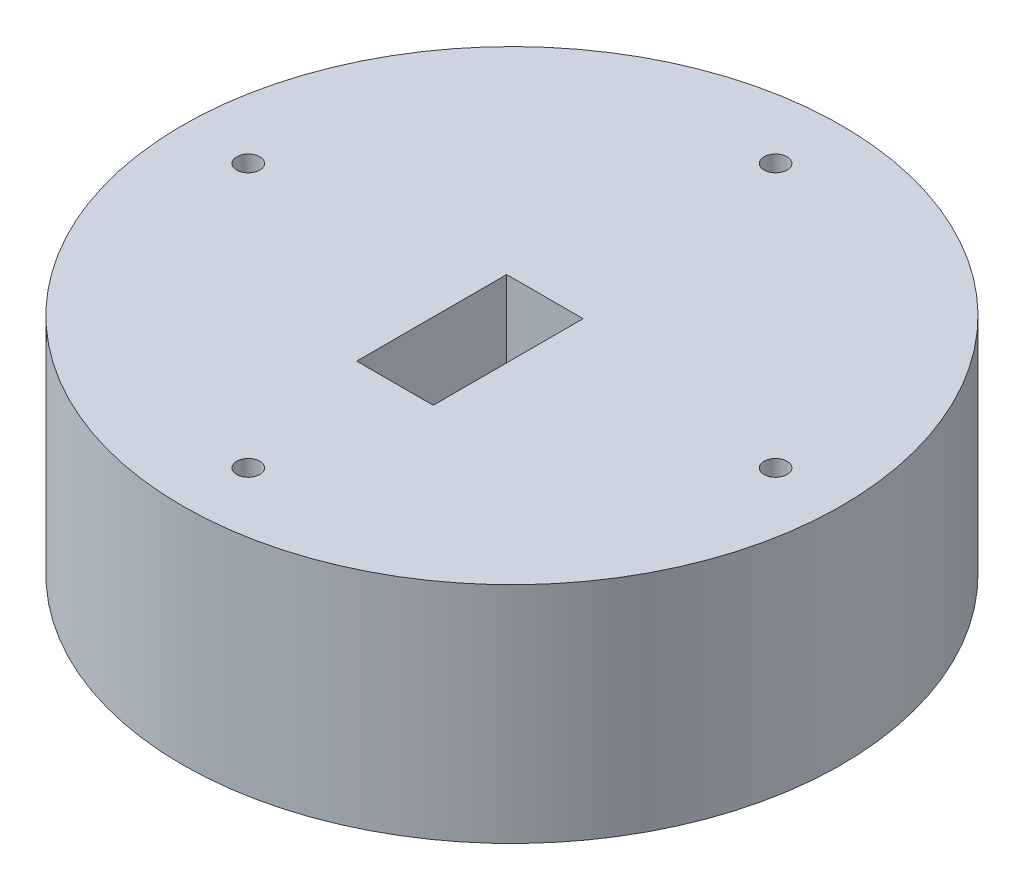
from build123d import *

# Parameters (mm, degrees)
SKETCH1_R           = 50
BOSS_EXTRUDE1_DEPTH = 30
SKETCH2_R           = 50
BOSS_EXTRUDE2_DEPTH = 4
SKETCH3_W           = 11.6
SKETCH3_H           = 22.75
CUT_EXTRUDE1_DEPTH  = 14
SKETCH5_R           = 1.75
CUT_EXTRUDE3_DEPTH  = 79.460180984


with BuildPart() as part:
    # Sketch1 → Boss-Extrude1 (new body)
    with BuildSketch(Plane(origin=(0, 0, 0), x_dir=(1, 0, 0), z_dir=(0, 1, 0))):
        with Locations(Location((0, 0, 0), (0, 0, 270))):
            Circle(SKETCH1_R)
    extrude(amount=BOSS_EXTRUDE1_DEPTH)

    # Sketch2 → Boss-Extrude2 (add)
    with BuildSketch(Plane(origin=(0, 30, 0), x_dir=(1, 0, 0), z_dir=(0, 1, 0))):
        with Locations(Location((0, 0, 0), (0, 0, 270))):
            Circle(SKETCH2_R)
    extrude(amount=BOSS_EXTRUDE2_DEPTH)

    # Sketch3 → Cut-Extrude1 (cut)
    with BuildSketch(Plane(origin=(0, 34, 0), x_dir=(1, 0, 0), z_dir=(0, 1, 0))):
        with Locations((0, -6.375)):
            Rectangle(SKETCH3_W, SKETCH3_H)
    extrude(amount=-CUT_EXTRUDE1_DEPTH, mode=Mode.SUBTRACT)

    # Sketch5 → Cut-Extrude3 (cut, through all)
    with BuildSketch(Plane(origin=(0, 34, 0), x_dir=(1, 0, 0), z_dir=(0, 1, 0))):
        with Locations(Location((0, 40, 0), (0, 0, 270))):
            Circle(SKETCH5_R)
        with Locations(Location((40, 0, 0), (0, 0, 270))):
            Circle(SKETCH5_R)
        with Locations(Location((0, -40, 0), (0, 0, 270))):
            Circle(SKETCH5_R)
        with Locations(Location((-40, 0, 0), (0, 0, 270))):
            Circle(SKETCH5_R)
    extrude(amount=-CUT_EXTRUDE3_DEPTH, mode=Mode.SUBTRACT)


solid = part.part
